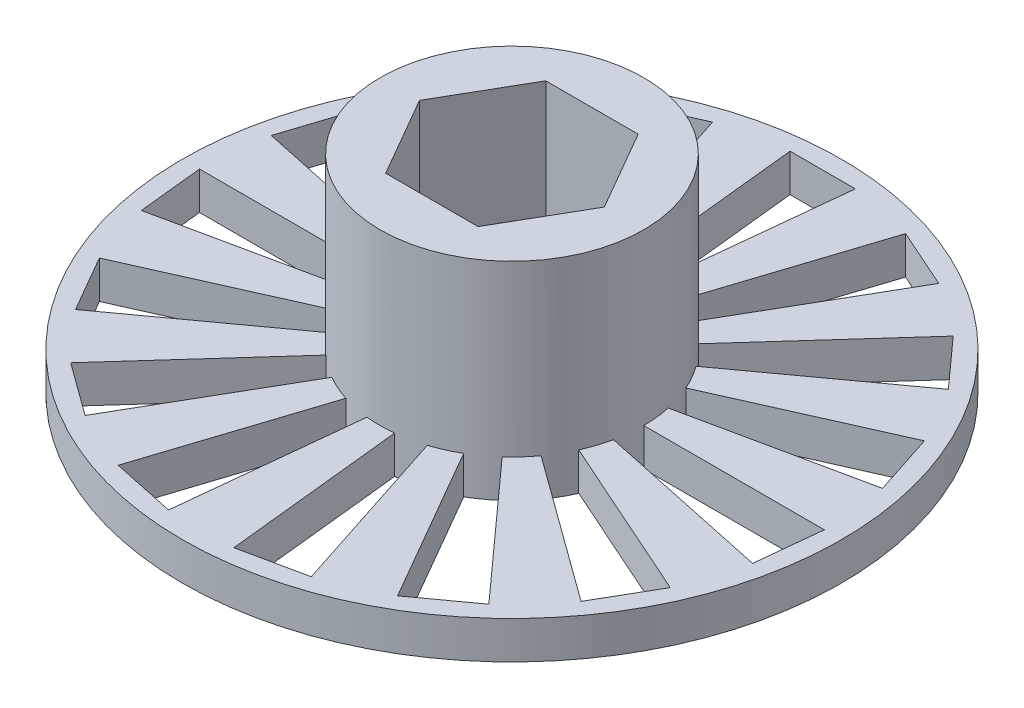
from build123d import *

# Parameters (mm, degrees)
BOSS_EXTRUDE1_DEPTH      = 1
BOSS_EXTRUDE1_DEPTH_BACK = 1
SKETCH1_R                = 17.5
BOSS_EXTRUDE2_START      = -1
SKETCH2_R                = 7
BOSS_EXTRUDE2_DEPTH      = 11


with BuildPart() as part:
    # Sketch1 → Boss-Extrude1 (new, two sides: drawn at the far end of the back side and taken through both)
    with BuildSketch(Plane(origin=(0, 0, 0), x_dir=(1, 0, 0), z_dir=(0, 1, 0)).offset(-BOSS_EXTRUDE1_DEPTH_BACK)):
        with Locations(Location((0, 0, 0), (0, 0, 270))):
            Circle(SKETCH1_R)
        Polygon((3.267901909, 5.66017214), (8.295443306, 14.368129278), (5.126865915, 15.778870824), (2.019674451, 6.21591881), align=None, mode=Mode.SUBTRACT)
        Polygon((0.683177529, 6.5), (1.734219882, 16.5), (-1.734219882, 16.5), (-0.683177529, 6.5), align=None, mode=Mode.SUBTRACT)
        Polygon((5.28757636, 3.841649096), (13.422309222, 9.751878473), (11.101470019, 12.329431536), (4.373306371, 4.857048787), align=None, mode=Mode.SUBTRACT)
        Polygon((6.392980823, 1.358870022), (16.228335934, 3.449439288), (15.156529103, 6.748121527), (5.970753889, 2.658350904), align=None, mode=Mode.SUBTRACT)
        Polygon((6.392980823, -1.358870022), (16.228335934, -3.449439288), (16.590886613, 0), (6.535803817, 0), align=None, mode=Mode.SUBTRACT)
        Polygon((5.28757636, -3.841649096), (13.422309222, -9.751878473), (15.156529103, -6.748121527), (5.970753889, -2.658350904), align=None, mode=Mode.SUBTRACT)
        Polygon((3.267901909, -5.66017214), (8.295443306, -14.368129278), (11.101470019, -12.329431536), (4.373306371, -4.857048787), align=None, mode=Mode.SUBTRACT)
        Polygon((0.683177529, -6.5), (1.734219882, -16.5), (5.126865915, -15.778870824), (2.019674451, -6.21591881), align=None, mode=Mode.SUBTRACT)
        Polygon((-2.019674451, -6.21591881), (-5.126865915, -15.778870824), (-1.734219882, -16.5), (-0.683177529, -6.5), align=None, mode=Mode.SUBTRACT)
        Polygon((-4.373306371, -4.857048787), (-11.101470019, -12.329431536), (-8.295443306, -14.368129278), (-3.267901909, -5.66017214), align=None, mode=Mode.SUBTRACT)
        Polygon((-5.970753889, -2.658350904), (-15.156529103, -6.748121527), (-13.422309222, -9.751878473), (-5.28757636, -3.841649096), align=None, mode=Mode.SUBTRACT)
        Polygon((-6.535803817, 0), (-16.590886613, 0), (-16.228335934, -3.449439288), (-6.392980823, -1.358870022), align=None, mode=Mode.SUBTRACT)
        Polygon((-5.970753889, 2.658350904), (-15.156529103, 6.748121527), (-16.228335934, 3.449439288), (-6.392980823, 1.358870022), align=None, mode=Mode.SUBTRACT)
        Polygon((-4.373306371, 4.857048787), (-11.101470019, 12.329431536), (-13.422309222, 9.751878473), (-5.28757636, 3.841649096), align=None, mode=Mode.SUBTRACT)
        Polygon((-2.019674451, 6.21591881), (-5.126865915, 15.778870824), (-8.295443306, 14.368129278), (-3.267901909, 5.66017214), align=None, mode=Mode.SUBTRACT)
        Polygon((4.907477288, 0), (2.453738644, 4.25), (-2.453738644, 4.25), (-4.907477288, 0), (-2.453738644, -4.25), (2.453738644, -4.25), align=None, mode=Mode.SUBTRACT)
    extrude(amount=BOSS_EXTRUDE1_DEPTH + BOSS_EXTRUDE1_DEPTH_BACK)

    # Sketch2 → Boss-Extrude2 (add)
    with BuildSketch(Plane(origin=(0, 0, 0), x_dir=(1, 0, 0), z_dir=(0, 1, 0)).offset(BOSS_EXTRUDE2_START)):
        with Locations(Location((0, 0, 0), (0, 0, 270))):
            Circle(SKETCH2_R)
        Polygon((4.907477288, 0), (2.453738644, 4.25), (-2.453738644, 4.25), (-4.907477288, 0), (-2.453738644, -4.25), (2.453738644, -4.25), align=None, mode=Mode.SUBTRACT)
    extrude(amount=BOSS_EXTRUDE2_DEPTH)


solid = part.part
